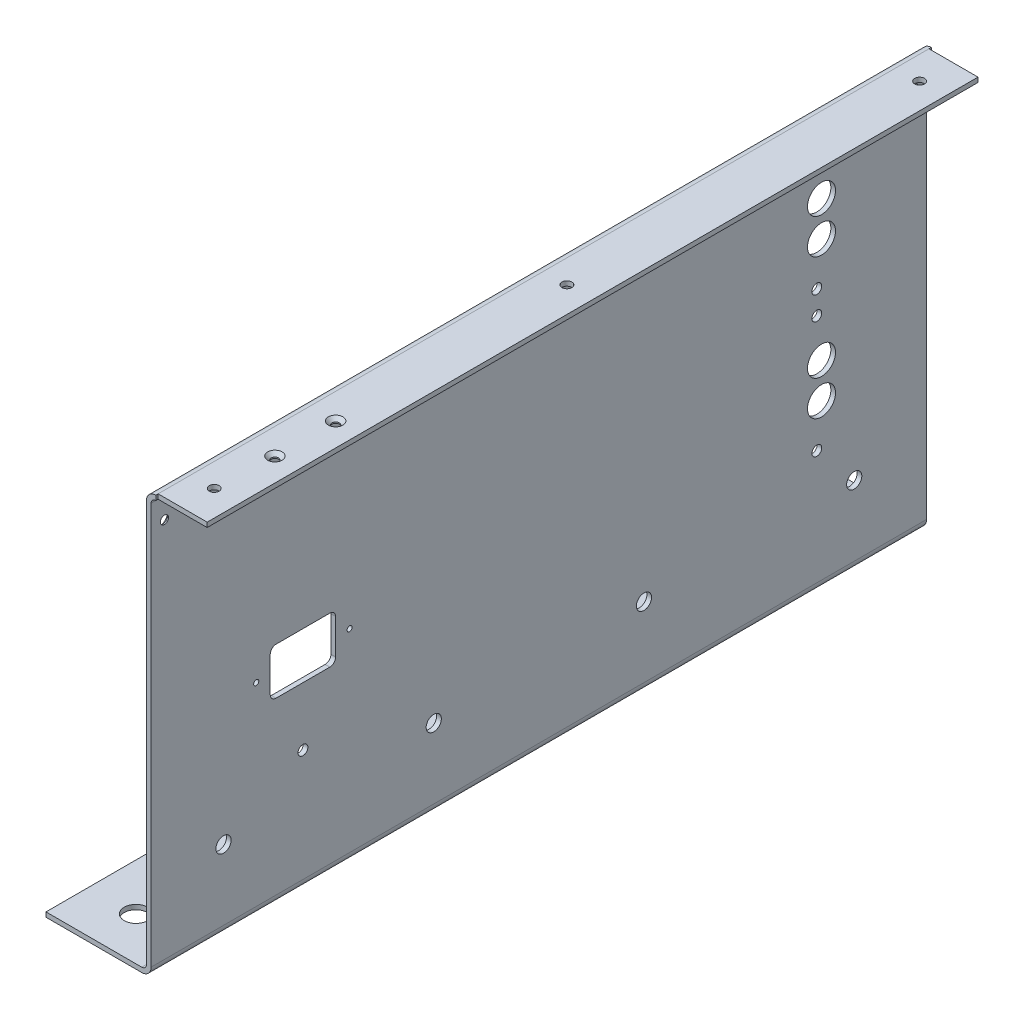
from build123d import *

# Parameters (mm, degrees)
EXTRUDE_1_DEPTH     = 332
SKETCH_2_R          = 3.25
CUT_EXTRUDE_1_DEPTH = 5
SKETCH_3_R          = 5
CUT_EXTRUDE_2_DEPTH = 5
SKETCH_4_W          = 26.179083289
SKETCH_4_H          = 3.25731829
CUT_EXTRUDE_3_DEPTH = 10
SKETCH_5_R          = 1.75
CUT_EXTRUDE_4_DEPTH = 2.5
CHAMFER_1_SIZE      = 1.5
SKETCH_6_R          = 2.1
SKETCH_6_R_2        = 6
CUT_EXTRUDE_5_DEPTH = 10
SKETCH_8_R          = 2.1
SKETCH_8_R_2        = 1.1
CUT_EXTRUDE_6_DEPTH = 10
SKETCH_9_R          = 1.6
CUT_EXTRUDE_7_DEPTH = 10
CHAMFER_2_SIZE      = 1.5
SKETCH_10_R         = 2.1
CUT_EXTRUDE_8_DEPTH = 10


with BuildPart() as part:
    # Эскиз1 → Вытянуть1 (new body)
    with BuildSketch(Plane.XY):
        with BuildLine():
            Line((-1, -68), (-1, 104))
            ThreePointArc((-1, 104), (0.171572875, 106.828427125), (3, 108))
            Line((3, 108), (24, 108))
            Line((24, 108), (24, 106))
            Line((24, 106), (3, 106))
            ThreePointArc((3, 106), (1.585786438, 105.414213562), (1, 104))
            Line((1, 104), (1, -68))
            ThreePointArc((1, -68), (-0.171572875, -70.828427125), (-3, -72))
            Line((-3, -72), (-44, -72))
            Line((-44, -72), (-44, -70))
            Line((-44, -70), (-3, -70))
            ThreePointArc((-3, -70), (-1.585786438, -69.414213562), (-1, -68))
        make_face()
    extrude(amount=EXTRUDE_1_DEPTH)

    # Эскиз2 → Вырез-Вытянуть1 (cut)
    with BuildSketch(Plane.ZY.offset(1)):
        with Locations((31, -38)):
            Circle(SKETCH_2_R)
        with Locations((121, -38)):
            Circle(SKETCH_2_R)
        with Locations((211, -38)):
            Circle(SKETCH_2_R)
        with Locations((301, -38)):
            Circle(SKETCH_2_R)
    extrude(amount=-CUT_EXTRUDE_1_DEPTH, mode=Mode.SUBTRACT)

    # Эскиз3 → Вырез-Вытянуть2 (cut)
    with BuildSketch(Plane(origin=(0, -70, 0), x_dir=(1, 0, 0), z_dir=(0, 1, 0))):
        with Locations(Location((-24, -18.5, 0), (0, 0, 270))):
            Circle(SKETCH_3_R)
        with Locations(Location((-24, -313.5, 0), (0, 0, 270))):
            Circle(SKETCH_3_R)
    extrude(amount=-CUT_EXTRUDE_2_DEPTH, mode=Mode.SUBTRACT)

    # Эскиз4 → Вырез-Вытянуть3 (cut)
    with BuildSketch(Plane(origin=(0, 108, 0), x_dir=(1, 0, 0), z_dir=(0, 1, 0))):
        with Locations((16.089541645, 0.628659145)):
            Rectangle(SKETCH_4_W, SKETCH_4_H)
        with Locations((16.089541645, -332.628659145)):
            Rectangle(SKETCH_4_W, SKETCH_4_H)
    extrude(amount=-CUT_EXTRUDE_3_DEPTH, mode=Mode.SUBTRACT)

    # Эскиз5 → Вырез-Вытянуть4 (cut)
    with BuildSketch(Plane.ZY.offset(1)):
        with Locations(Location((5.7, 95, 0), (0, 0, 270))):
            Circle(SKETCH_5_R)
        with Locations(Location((326.3, 95, 0), (0, 0, 270))):
            Circle(SKETCH_5_R)
    extrude(amount=-CUT_EXTRUDE_4_DEPTH, mode=Mode.SUBTRACT)

    # Фаска1
    chamfer_1_edges = [part.edges().sort_by_distance(p)[0] for p in [
        (-1, 96.75, 326.3),
        (-1, 96.75, 5.7),
    ]]
    chamfer(chamfer_1_edges, length=CHAMFER_1_SIZE)

    # Эскиз6 → Вырез-Вытянуть5 (cut)
    with BuildSketch(Plane.ZY.offset(1)):
        with Locations(Location((47, 91, 0), (0, 0, 270))):
            Circle(SKETCH_6_R)
        with Locations(Location((47, 41, 0), (0, 0, 270))):
            Circle(SKETCH_6_R)
        with Locations(Location((47, 31, 0), (0, 0, 270))):
            Circle(SKETCH_6_R)
        with Locations(Location((47, -19, 0), (0, 0, 270))):
            Circle(SKETCH_6_R)
        with Locations(Location((45, -1.5, 0), (0, 0, 270))):
            Circle(SKETCH_6_R_2)
        with Locations(Location((45, 58.5, 0), (0, 0, 270))):
            Circle(SKETCH_6_R_2)
        with Locations(Location((45, 13.5, 0), (0, 0, 270))):
            Circle(SKETCH_6_R_2)
        with Locations(Location((45, 73.5, 0), (0, 0, 270))):
            Circle(SKETCH_6_R_2)
    extrude(amount=-CUT_EXTRUDE_5_DEPTH, mode=Mode.SUBTRACT)

    # Эскиз8 → Вырез-Вытянуть6 (cut)
    with BuildSketch(Plane.ZY.offset(1)):
        with Locations(Location((267, -20, 0), (0, 0, 270))):
            Circle(SKETCH_8_R)
        with Locations(Location((287, 15, 0), (0, 0, 270))):
            Circle(SKETCH_8_R_2)
        with Locations(Location((247, 15, 0), (0, 0, 270))):
            Circle(SKETCH_8_R_2)
        with BuildLine():
            Line((255.5, 5), (278.5, 5))
            ThreePointArc((278.5, 5), (280.267766953, 5.732233047), (281, 7.5))
            Line((281, 7.5), (281, 22.5))
            ThreePointArc((281, 22.5), (280.267766953, 24.267766953), (278.5, 25))
            Line((278.5, 25), (255.5, 25))
            ThreePointArc((255.5, 25), (253.732233047, 24.267766953), (253, 22.5))
            Line((253, 22.5), (253, 7.5))
            ThreePointArc((253, 7.5), (253.732233047, 5.732233047), (255.5, 5))
        make_face()
    extrude(amount=-CUT_EXTRUDE_6_DEPTH, mode=Mode.SUBTRACT)

    # Эскиз9 → Вырез-Вытянуть7 (cut)
    with BuildSketch(Plane(origin=(0, 108, 0), x_dir=(1, 0, 0), z_dir=(0, 1, 0))):
        with Locations(Location((14, -266, 0), (0, 0, 270))):
            Circle(SKETCH_9_R)
        with Locations(Location((14, -292, 0), (0, 0, 270))):
            Circle(SKETCH_9_R)
    extrude(amount=-CUT_EXTRUDE_7_DEPTH, mode=Mode.SUBTRACT)

    # Фаска2
    chamfer_2_edges = [part.edges().sort_by_distance(p)[0] for p in [
        (14, 108, 264.4),
        (14, 108, 290.4),
    ]]
    chamfer(chamfer_2_edges, length=CHAMFER_2_SIZE)

    # Эскиз10 → Вырез-Вытянуть8 (cut)
    with BuildSketch(Plane(origin=(0, 108, 0), x_dir=(1, 0, 0), z_dir=(0, 1, 0))):
        with Locations(Location((13, -15, 0), (0, 0, 270))):
            Circle(SKETCH_10_R)
        with Locations(Location((13, -166, 0), (0, 0, 270))):
            Circle(SKETCH_10_R)
        with Locations(Location((13, -317, 0), (0, 0, 270))):
            Circle(SKETCH_10_R)
    extrude(amount=-CUT_EXTRUDE_8_DEPTH, mode=Mode.SUBTRACT)


solid = part.part
